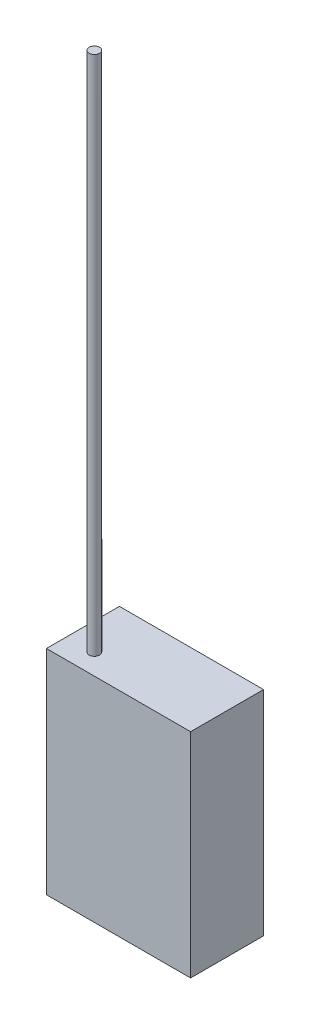
from build123d import *

# Parameters (mm, degrees)
SKETCH1_W           = 13.826897396
SKETCH1_H           = 20.463808146
BOSS_EXTRUDE1_DEPTH = 7
SKETCH2_R           = 0.5
BOSS_EXTRUDE2_DEPTH = 50


with BuildPart() as part:
    # Sketch1 → Boss-Extrude1 (new body)
    with BuildSketch(Plane.XY):
        with Locations((-56.093861986, 1.78803904)):
            Rectangle(SKETCH1_W, SKETCH1_H)
    extrude(amount=BOSS_EXTRUDE1_DEPTH)

    # Sketch2 → Boss-Extrude2 (add)
    with BuildSketch(Plane(origin=(0, 12.019943113, 0), x_dir=(1, 0, 0), z_dir=(0, 1, 0))):
        with Locations(Location((-60.408534805, -5, 0), (0, 0, 90))):
            Circle(SKETCH2_R)
    extrude(amount=BOSS_EXTRUDE2_DEPTH)


solid = part.part
